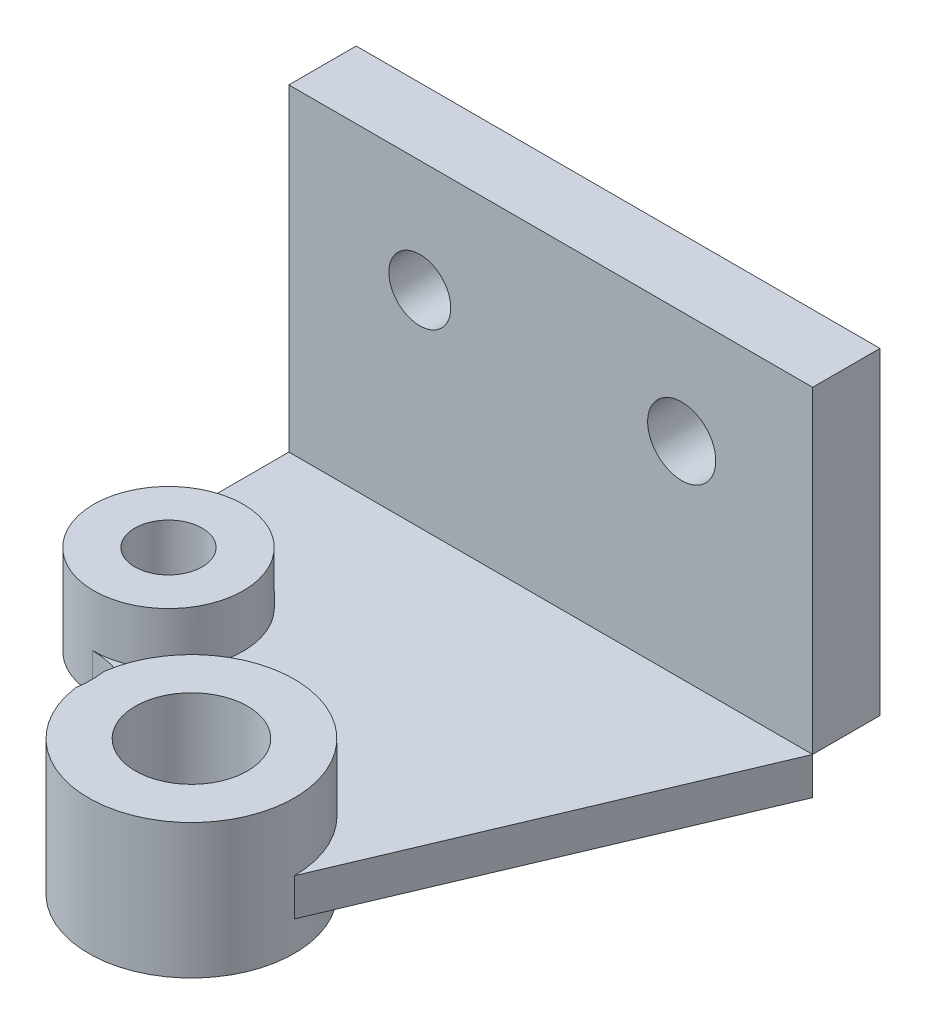
from build123d import *
from build123d.topology import SkipClean

# Parameters (mm, degrees)
SKETCH1_W           = 140
SKETCH1_H           = 85
BOSS_EXTRUDE1_DEPTH = 18
SKETCH6_R           = 15
SKETCH6_R_2         = 9
BOSS_EXTRUDE6_DEPTH = 10
SKETCH6_4_R         = 15
BOSS_EXTRUDE7_DEPTH = 18
SKETCH6_5_R         = 9
BOSS_EXTRUDE8_DEPTH = 14
SKETCH13_R          = 8.270703546
SKETCH13_R_2        = 9.098859586
CUT_EXTRUDE1_DEPTH  = 18


with BuildPart() as part:
    # Sketch1 → Boss-Extrude1 (new body)
    with BuildSketch(Plane.XY):
        with Locations((70, 42.5)):
            Rectangle(SKETCH1_W, SKETCH1_H)
    extrude(amount=BOSS_EXTRUDE1_DEPTH)

    # Sketch13 → Cut-Extrude1 (cut)
    with BuildSketch(Plane.XY.offset(18)):
        with Locations((35, 55)):
            Circle(SKETCH13_R)
        with Locations((105, 55)):
            Circle(SKETCH13_R_2)
    extrude(amount=-CUT_EXTRUDE1_DEPTH, mode=Mode.SUBTRACT)


with BuildPart() as body_2:
    # Sketch6 → Boss-Extrude6 (new body)
    with BuildSketch(Plane.XZ):
        with BuildLine():
            ThreePointArc((44.050656558, 119.058334348), (38.471531135, 99.064679581), (19.712968781, 90.177092179))
            ThreePointArc((19.712968781, 90.177092179), (5.756745028, 84.219439982), (0, 70.179151958))
            Line((0, 70.179151958), (0, 18))
            Line((0, 18), (140, 18))
            Line((140, 18), (98.797681926, 115.336828121))
            ThreePointArc((98.797681926, 115.336828121), (73.162729161, 142.773511573), (44.050656558, 119.058334348))
        make_face()
        with Locations((71.297681926, 115.336828121)):
            Circle(SKETCH6_R, mode=Mode.SUBTRACT)
        with Locations((20, 70.179151958)):
            Circle(SKETCH6_R_2, mode=Mode.SUBTRACT)
    extrude(amount=BOSS_EXTRUDE6_DEPTH)

    # Sketch6<4> → Boss-Extrude7 (add, symmetric)
    with SkipClean():  # the faces are left unmerged after this step: merging them gives an invalid solid
        with BuildSketch(Plane.XZ):
            with BuildLine():
                ThreePointArc((44.074445993, 111.445115727), (73.248452524, 87.906106401), (98.797681926, 115.336828121))
                ThreePointArc((98.797681926, 115.336828121), (73.162729161, 142.773511573), (44.050656558, 119.058334348))
                ThreePointArc((44.050656558, 119.058334348), (44.354057707, 115.252635924), (44.074445993, 111.445115727))
            make_face()
            with Locations((71.297681926, 115.336828121)):
                Circle(SKETCH6_4_R, mode=Mode.SUBTRACT)
        extrude(amount=BOSS_EXTRUDE7_DEPTH, both=True)

    # Sketch6<5> → Boss-Extrude8 (add)
    with SkipClean():  # the faces are left unmerged after this step: merging them gives an invalid solid
        with BuildSketch(Plane.XZ):
            with BuildLine():
                ThreePointArc((40, 70.179151958), (34.040288025, 84.422406929), (19.712968781, 90.177092179))
                ThreePointArc((19.712968781, 90.177092179), (5.756745028, 84.219439982), (0, 70.179151958))
                ThreePointArc((0, 70.179151958), (20, 50.179151958), (40, 70.179151958))
            make_face()
            with Locations((20, 70.179151958)):
                Circle(SKETCH6_5_R, mode=Mode.SUBTRACT)
        extrude(amount=-BOSS_EXTRUDE8_DEPTH)


solid = Compound([part.part, body_2.part])
